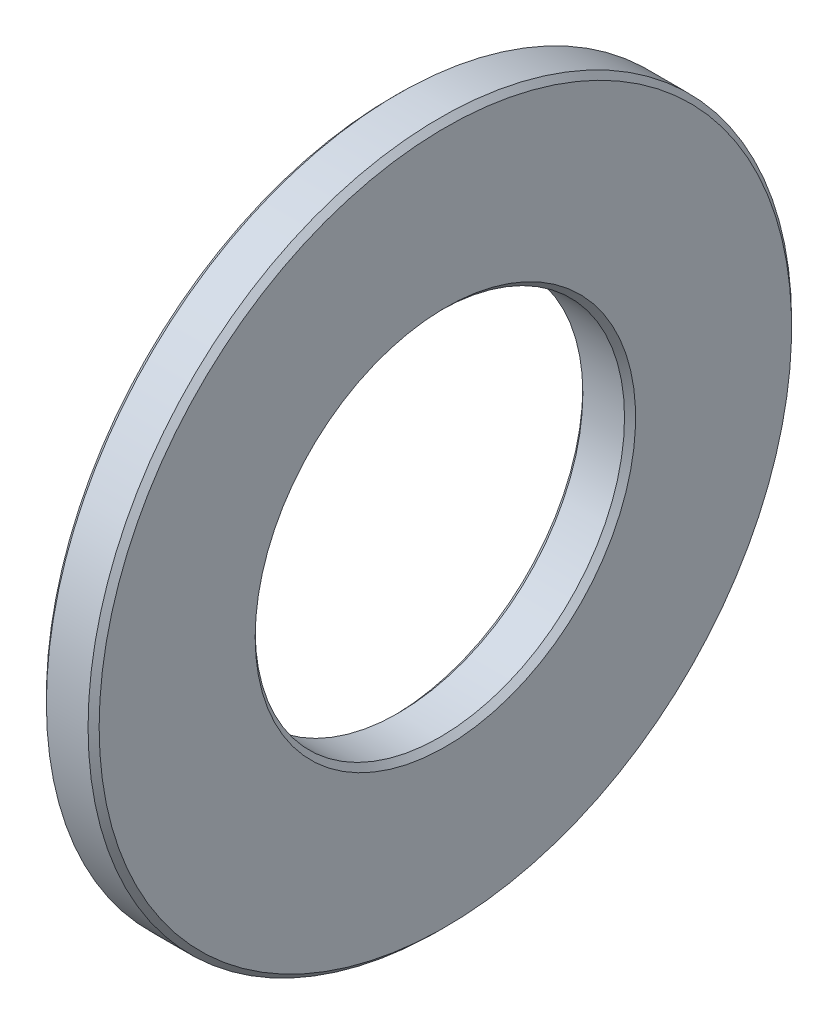
from build123d import *

# Parameters (mm, degrees)
SKETCH1_W     = 2.38125
SKETCH1_H     = 7.540625
CHAMFER1_SIZE = 0.25


with BuildPart() as part:
    # Sketch1 → Revolve1 (revolve)
    with BuildSketch(Plane.XY, mode=Mode.PRIVATE) as revolve1_sk:
        with Locations((1.190625, 12.1046875)):
            Rectangle(SKETCH1_W, SKETCH1_H)
    revolve(revolve1_sk.sketch.rotate(Axis((0, 0, 0), (1, 0, 0)), 90), axis=Axis((0, 0, 0), (1, 0, 0)))

    # Chamfer1
    chamfer1_edges = [part.edges().sort_by_distance(p)[0] for p in [
        (0, 0, -15.875),
        (2.38125, 0, -15.875),
        (2.38125, 0, -8.334375),
        (0, 0, -8.334375),
    ]]
    chamfer(chamfer1_edges, length=CHAMFER1_SIZE)


solid = part.part
